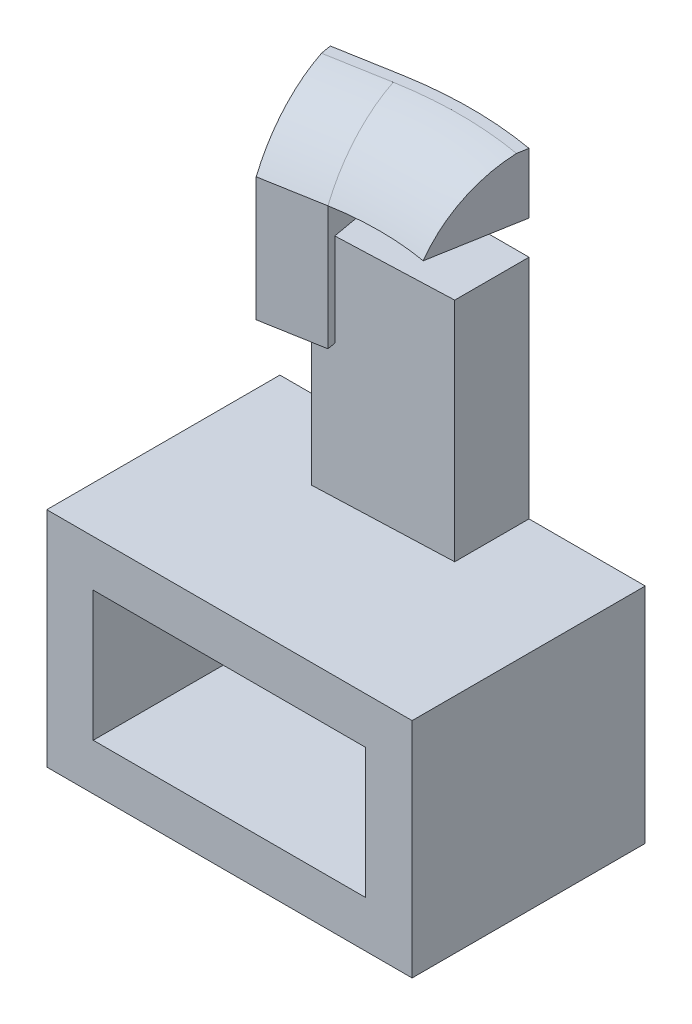
from build123d import *

# Parameters (mm, degrees)
SKETCH1_W           = 59
SKETCH1_H           = 36
SKETCH1_W_2         = 44
SKETCH1_H_2         = 21
BOSS_EXTRUDE1_DEPTH = 10
SKETCH1_2_W         = 59
SKETCH1_2_H         = 36
SKETCH1_2_W_2       = 44
SKETCH1_2_H_2       = 21
BOSS_EXTRUDE2_DEPTH = 5
BOSS_EXTRUDE3_DEPTH = 36.6
REVOLVE1_ANGLE      = 20
BOSS_EXTRUDE4_DEPTH = 10
SKETCH1_5_W         = 44
SKETCH1_5_H         = 21
BOSS_EXTRUDE6_DEPTH = 7.65
BOSS_EXTRUDE7_START = 7.65
SKETCH1_6_W         = 59
SKETCH1_6_H         = 36
SKETCH1_6_W_2       = 44
SKETCH1_6_H_2       = 21
BOSS_EXTRUDE7_DEPTH = 25


with BuildPart() as part:
    # Sketch1 → Boss-Extrude1 (new body)
    with BuildSketch(Plane.XY):
        Rectangle(SKETCH1_W, SKETCH1_H)
        Rectangle(SKETCH1_W_2, SKETCH1_H_2, mode=Mode.SUBTRACT)
    extrude(amount=BOSS_EXTRUDE1_DEPTH)

    # Sketch1<2> → Boss-Extrude2 (add)
    # profile 1 of 2: a face of its own
    with BuildSketch(Plane.XY):
        Rectangle(SKETCH1_2_W, SKETCH1_2_H)
        Rectangle(SKETCH1_2_W_2, SKETCH1_2_H_2, mode=Mode.SUBTRACT)
    # profile 2 of 2: a face of its own
    with BuildSketch(Plane.XY):
        Rectangle(SKETCH1_2_W_2, SKETCH1_2_H_2)
    extrude(amount=-BOSS_EXTRUDE2_DEPTH)

    # Sketch4 → Boss-Extrude3 (add)
    with BuildSketch(Plane(origin=(0, 18, 0), x_dir=(1, 0, 0), z_dir=(0, 1, 0))):
        Polygon((-11.59160023, 5), (-11.59160023, -7.844664049), (10.731401476, -7), (10.731401476, 5), align=None)
    extrude(amount=BOSS_EXTRUDE3_DEPTH)

    # Sketch1<5> → Boss-Extrude6 (add)
    with BuildSketch(Plane.XY):
        Rectangle(SKETCH1_5_W, SKETCH1_5_H)
    extrude(amount=BOSS_EXTRUDE6_DEPTH)

    # Sketch1<6> → Boss-Extrude7 (add)
    with BuildSketch(Plane.XY.offset(BOSS_EXTRUDE7_START)):
        Rectangle(SKETCH1_6_W, SKETCH1_6_H)
        Rectangle(SKETCH1_6_W_2, SKETCH1_6_H_2, mode=Mode.SUBTRACT)
    extrude(amount=BOSS_EXTRUDE7_DEPTH)


with BuildPart() as body_2:
    # Sketch6 → Revolve1 (revolve, symmetric)
    with BuildSketch(Plane(origin=(0, 0, 0), x_dir=(0, 0, -1), z_dir=(1, 0, 0))) as revolve1_sk:
        with BuildLine():
            Line((6.375, 59.6), (-8.375, 59.6))
            ThreePointArc((-8.375, 59.6), (-2.924218778, 65.873958371), (4.625, 69.35))
            Line((4.625, 69.35), (6.375, 69.35))
            Line((6.375, 69.35), (6.375, 59.6))
        make_face()
    revolve(axis=Axis((0, 146.671144668, 52.68), (0, -1, 0)), revolution_arc=REVOLVE1_ANGLE / 2)
    revolve(revolve1_sk.sketch, axis=Axis((0, 146.671144668, 52.68), (0, 1, 0)), revolution_arc=REVOLVE1_ANGLE / 2)

    # Sketch8 → Boss-Extrude4 (add)
    with BuildSketch(Plane(origin=(-9.008810575, 0, 1.588496368), x_dir=(0.17364817766693072, 0, 0.9848077530122081), z_dir=(-0.9848077530122081, 0, 0.17364817766693072))):
        with BuildLine():
            Line((-7.175327571, 69.35), (-7.175327571, 59.6))
            Line((-7.175327571, 59.6), (-7.175327571, 39.6))
            Line((-7.175327571, 39.6), (7.574672429, 39.6))
            Line((7.574672429, 39.6), (7.574672429, 59.6))
            ThreePointArc((7.574672429, 59.6), (2.109528791, 65.854808483), (-5.425327571, 69.35))
            Line((-5.425327571, 69.35), (-7.175327571, 69.35))
        make_face()
    extrude(amount=BOSS_EXTRUDE4_DEPTH)


solid = Compound([part.part, body_2.part])
